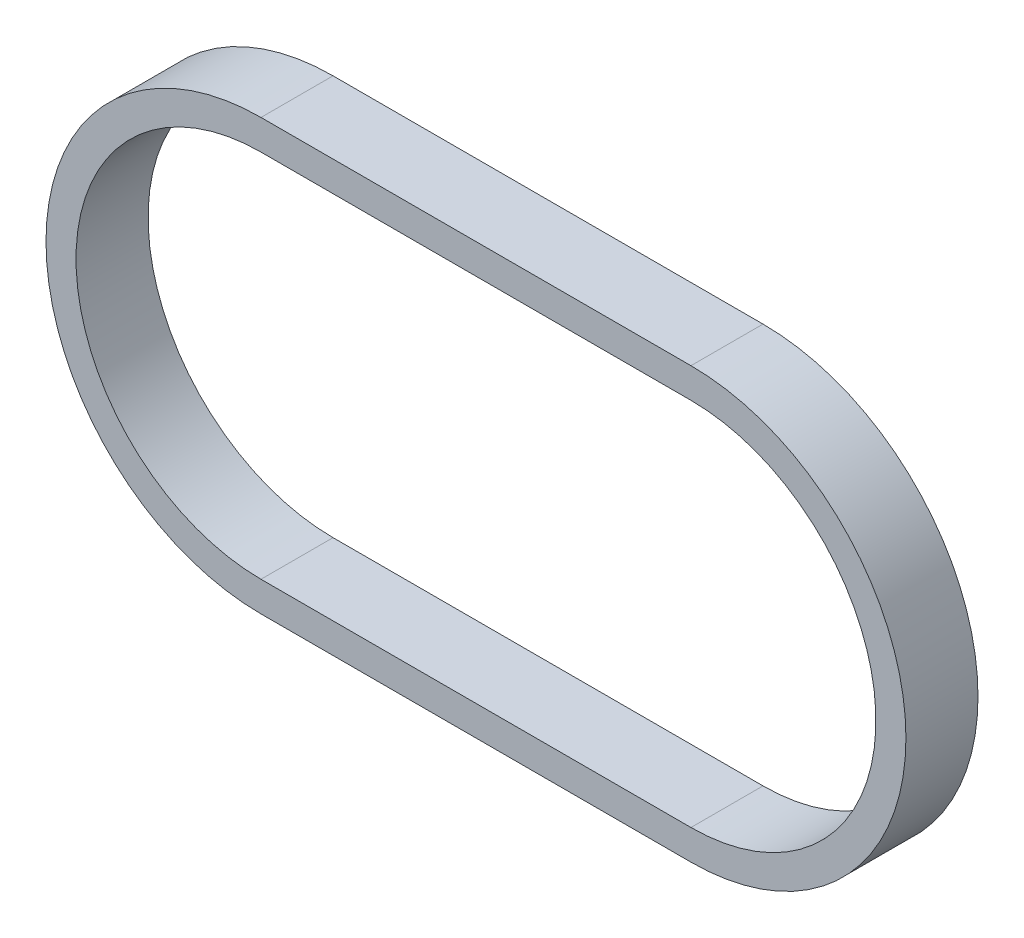
from build123d import *

# Parameters (mm, degrees)
BOSS_EXTRU_2_DEPTH = 6


with BuildPart() as part:
    # Esquisse4 → Boss.-Extru.2 (new body)
    with BuildSketch(Plane.XY):
        with BuildLine():
            Line((-17.9, -17.9), (17.9, -17.9))
            ThreePointArc((17.9, -17.9), (35.8, 0), (17.9, 17.9))
            Line((17.9, 17.9), (-17.9, 17.9))
            ThreePointArc((-17.9, 17.9), (-35.8, 0), (-17.9, -17.9))
        make_face()
        with BuildLine():
            Line((17.9, -15.4), (-17.9, -15.4))
            ThreePointArc((-17.9, -15.4), (-33.3, 0), (-17.9, 15.4))
            Line((-17.9, 15.4), (17.9, 15.4))
            ThreePointArc((17.9, 15.4), (33.3, 0), (17.9, -15.4))
        make_face(mode=Mode.SUBTRACT)
    extrude(amount=BOSS_EXTRU_2_DEPTH)


solid = part.part
